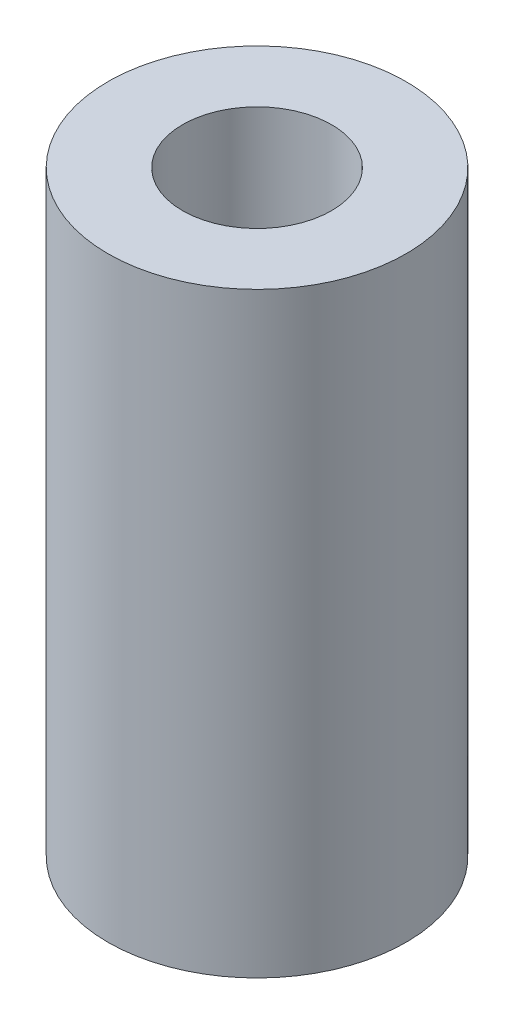
from build123d import *

# Parameters (mm, degrees)
SKETCH1_R           = 4
SKETCH1_R_2         = 2
BOSS_EXTRUDE1_DEPTH = 8


with BuildPart() as part:
    # Sketch1 → Boss-Extrude1 (new, symmetric)
    with BuildSketch(Plane(origin=(0, 0, 0), x_dir=(1, 0, 0), z_dir=(0, 1, 0))):
        with Locations(Location((0, 0, 0), (0, 0, 270))):
            Circle(SKETCH1_R)
        with Locations(Location((0, 0, 0), (0, 0, 270))):
            Circle(SKETCH1_R_2, mode=Mode.SUBTRACT)
    extrude(amount=BOSS_EXTRUDE1_DEPTH, both=True)


solid = part.part
